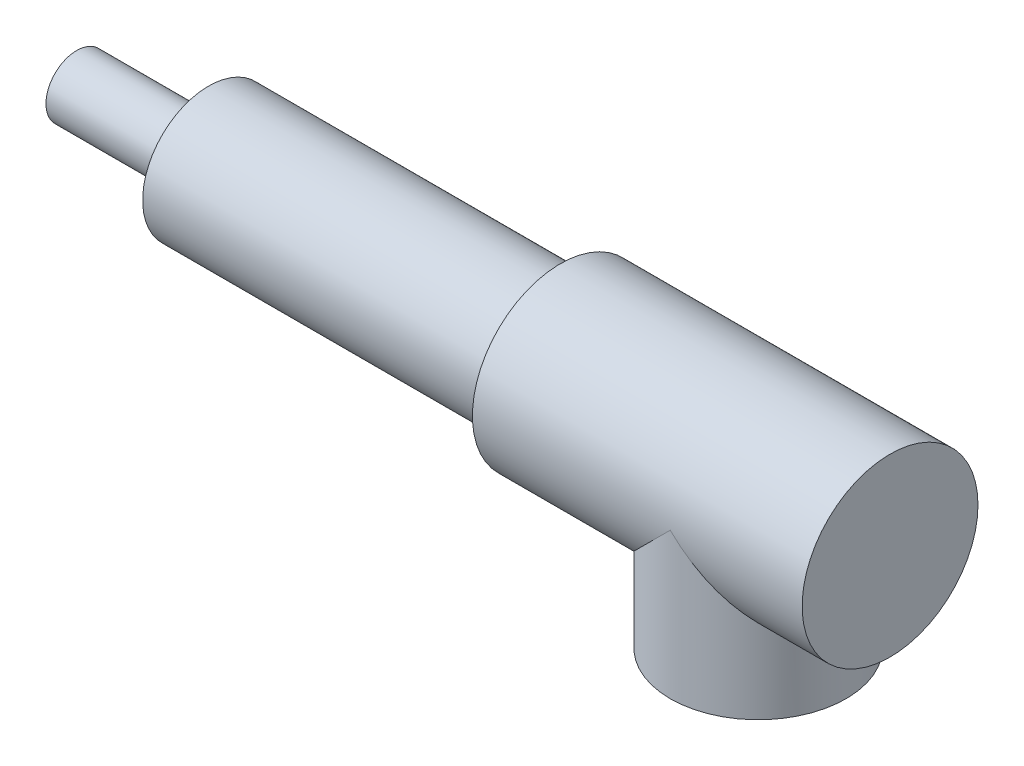
from build123d import *

# Parameters (mm, degrees)
SKETCH2_R           = 20
SKETCH4_R           = 20
BOSS_EXTRUDE1_DEPTH = 33.2


with BuildPart() as part:
    # Sweep1: sweep along a path in Sketch1
    with BuildLine(Plane.XY) as sweep1_path:
        Line((0, 0), (75, 0))
    # Sketch2 → Sweep1 (sweep)
    with BuildSketch(Plane(origin=(0, 0, 0), x_dir=(0, 0, -1), z_dir=(1, 0, 0))):
        Circle(SKETCH2_R)
    sweep(path=sweep1_path.line)

    # Sketch4 → Boss-Extrude1 (add)
    with BuildSketch(Plane(origin=(0, 0, 0), x_dir=(1, 0, 0), z_dir=(0, 1, 0))):
        with Locations(Location((45, 0, 0), (0, 0, 270))):
            Circle(SKETCH4_R)
    extrude(amount=-BOSS_EXTRUDE1_DEPTH)

    # Sketch5 → Revolve1 (revolve)
    with BuildSketch(Plane(origin=(0, 0, 0), x_dir=(1, 0, 0), z_dir=(0, 1, 0))):
        Polygon((0, 0), (-110, 0), (-110, 7), (-80, 7), (-80, 15), (0, 15), align=None)
    revolve(axis=Axis((-110, 0, 0), (-1, 0, 0)))


solid = part.part
